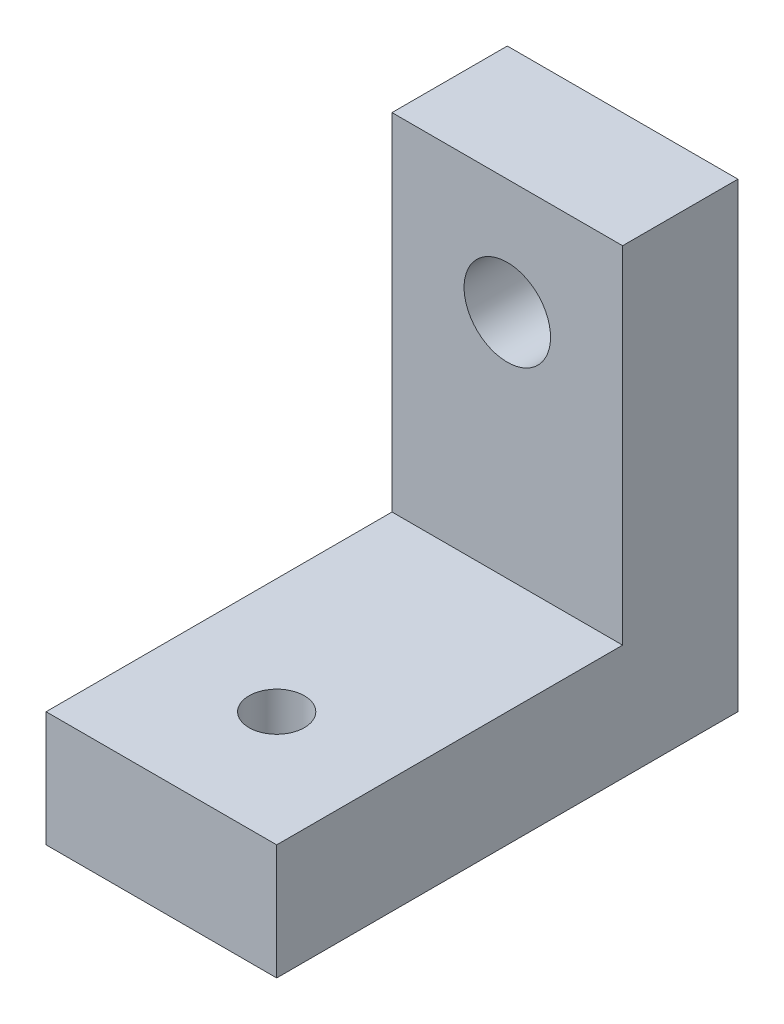
from build123d import *

# Parameters (mm, degrees)
SKETCH1_R           = 2.38125
BOSS_EXTRUDE1_DEPTH = 6.35
SKETCH2_W           = 12.7
SKETCH2_H           = 6.35
BOSS_EXTRUDE2_DEPTH = 19.05
SKETCH3_R           = 1.524
CUT_EXTRUDE1_DEPTH  = 19.05


with BuildPart() as part:
    # Sketch1 → Boss-Extrude1 (new body)
    with BuildSketch(Plane.XY):
        Polygon((-6.35, 0), (-6.35, -19.05), (6.35, -19.05), (6.35, 0), (6.35, 6.35), (-6.35, 6.35), align=None)
        Circle(SKETCH1_R, mode=Mode.SUBTRACT)
    extrude(amount=BOSS_EXTRUDE1_DEPTH)

    # Sketch2 → Boss-Extrude2 (add)
    with BuildSketch(Plane.XY.offset(6.35)):
        with Locations((0, -15.875)):
            Rectangle(SKETCH2_W, SKETCH2_H)
    extrude(amount=BOSS_EXTRUDE2_DEPTH)

    # Sketch3 → Cut-Extrude1 (cut)
    with BuildSketch(Plane(origin=(0, -12.7, 0), x_dir=(1, 0, 0), z_dir=(0, 1, 0))):
        with Locations(Location((0, -19.05, 0), (0, 0, 270))):
            Circle(SKETCH3_R)
    extrude(amount=-CUT_EXTRUDE1_DEPTH, mode=Mode.SUBTRACT)


solid = part.part
